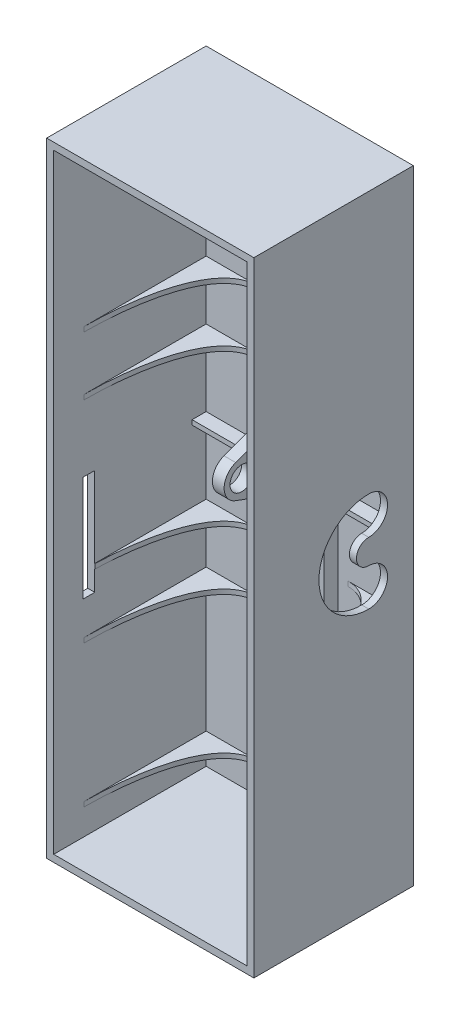
from build123d import *

# Parameters (mm, degrees)
BOSS_EXTRUDE1_DEPTH      = 68
SKETCH2_W                = 88.35
SKETCH2_H                = 263
BOSS_EXTRUDE2_DEPTH      = 3
SKETCH3_R                = 5
BOSS_EXTRUDE3_DEPTH      = 5
BOSS_EXTRUDE6_START      = 8
BOSS_EXTRUDE6_DEPTH      = 8
M6_CLEARANCE_HOLE1_D     = 6.6
M6_CLEARANCE_HOLE1_DEPTH = 8
CUT_EXTRUDE1_REACH       = 286.827
SKETCH11_W               = 88.35
SKETCH11_H               = 68
BOSS_EXTRUDE7_DEPTH      = 3
SKETCH13_W               = 21.852514987
SKETCH13_H               = 2
BOSS_EXTRUDE8_DEPTH      = 52
CUT_EXTRUDE2_REACH       = 277.542
SKETCH15_W               = 2
SKETCH15_H               = 260
SKETCH15_W_2             = 26.175
SKETCH15_H_2             = 2
SKETCH15_W_3             = 23.175
BOSS_EXTRUDE9_DEPTH      = 6
SKETCH16_W               = 15
SKETCH16_H               = 50
BOSS_EXTRUDE10_DEPTH     = 4
M6_TAPPED_HOLE2_D        = 5
SKETCH20_W               = 5
SKETCH20_H               = 45
CUT_EXTRUDE4_DEPTH       = 10


with BuildPart() as part:
    # Sketch1 → Boss-Extrude1 (new body)
    with BuildSketch(Plane.XY):
        Polygon((0, 263), (0, 0), (88.35, 0), (88.35, 263.092759022), (85.35, 263.092759022), (85.35, 3), (3, 3), (3, 263), align=None)
    extrude(amount=BOSS_EXTRUDE1_DEPTH)

    # Sketch2 → Boss-Extrude2 (add)
    with BuildSketch(Plane.XY):
        with Locations((44.175, 131.5)):
            Rectangle(SKETCH2_W, SKETCH2_H)
    extrude(amount=BOSS_EXTRUDE2_DEPTH)

    # Sketch3 → Boss-Extrude3 (add)
    with BuildSketch(Plane(origin=(34.175, 0, 0), x_dir=(0, 0, -1), z_dir=(1, 0, 0))):
        with BuildLine():
            Line((-21.565151075, 140.047694656), (-3, 146.804857042))
            Line((-3, 146.804857042), (-3, 119.195142958))
            Line((-3, 119.195142958), (-21.565151075, 125.952305344))
            ThreePointArc((-21.565151075, 125.952305344), (-26.5, 133), (-21.565151075, 140.047694656))
        make_face()
        with Locations(Location((-19, 133, 0), (0, 0, 90))):
            Circle(SKETCH3_R, mode=Mode.SUBTRACT)
    extrude(amount=-BOSS_EXTRUDE3_DEPTH)

    # Sketch6 → Boss-Extrude6 (add)
    with BuildSketch(Plane(origin=(54.175, 0, 0), x_dir=(0, 0, -1), z_dir=(1, 0, 0)).offset(BOSS_EXTRUDE6_START)):
        with BuildLine():
            Line((-19, 138), (-3, 138))
            Line((-3, 138), (-3, 128))
            Line((-3, 128), (-19, 128))
            ThreePointArc((-19, 128), (-24, 133), (-19, 138))
        make_face()
    extrude(amount=-BOSS_EXTRUDE6_DEPTH)

    # M6 Clearance Hole1
    with Locations(Plane.ZY.offset(-54.175)):
        with Locations((19, 133)):
            Hole(M6_CLEARANCE_HOLE1_D / 2, depth=M6_CLEARANCE_HOLE1_DEPTH)

    # Sketch10 → Cut-Extrude1 (cut, up to next)
    with BuildSketch(Plane.ZY.offset(-85.35), mode=Mode.PRIVATE) as cut_extrude1_sk1:
        with BuildLine():
            ThreePointArc((19, 111.75), (40.25, 133), (19, 154.25))
            ThreePointArc((19, 154.25), (11, 146.25), (19, 138.25))
            ThreePointArc((19, 138.25), (24.25, 133), (19, 127.75))
            ThreePointArc((19, 127.75), (11, 119.75), (19, 111.75))
        make_face()
    cut_extrude1_tool1 = extrude(cut_extrude1_sk1.sketch, amount=-CUT_EXTRUDE1_REACH, mode=Mode.PRIVATE) & part.part
    add(cut_extrude1_tool1.solids().sort_by_distance((85.35, 133, 25.479221))[0], mode=Mode.SUBTRACT)

    # Sketch11 → Boss-Extrude7 (add)
    with BuildSketch(Plane(origin=(0, 263, 0), x_dir=(1, 0, 0), z_dir=(0, 1, 0))):
        with Locations((44.175, -34)):
            Rectangle(SKETCH11_W, SKETCH11_H)
    extrude(amount=BOSS_EXTRUDE7_DEPTH)

    # Sketch13 → Boss-Extrude8 (add)
    with BuildSketch(Plane.XY.offset(3)):
        with Locations((13.926257494, 250.979741765)):
            Rectangle(SKETCH13_W, SKETCH13_H)
        with Locations((13.926257494, 190.418933856)):
            Rectangle(SKETCH13_W, SKETCH13_H)
        with Locations((13.926257494, 165.349802202)):
            Rectangle(SKETCH13_W, SKETCH13_H)
        with Locations((13.926257494, 15.020258235)):
            Rectangle(SKETCH13_W, SKETCH13_H)
        with Locations((13.926257494, 75.581066144)):
            Rectangle(SKETCH13_W, SKETCH13_H)
        with Locations((13.926257494, 100.650197798)):
            Rectangle(SKETCH13_W, SKETCH13_H)
    boss_extrude8 = extrude(amount=BOSS_EXTRUDE8_DEPTH)

    # Cut-Extrude2: up to this face of the body (flat: up to its plane)
    cut_extrude2_end = Plane(part.part.faces().sort_by_distance((13.926257494, 251.979741765, 29))[0])
    # Sketch14 → Cut-Extrude2 (cut, up to the picked face)
    with BuildSketch(Plane.XZ.offset(-14.020258235), mode=Mode.PRIVATE) as cut_extrude2_sk1:
        with BuildLine():
            Line((24.852514987, 3), (24.852514987, 55))
            Line((24.852514987, 55), (3, 55))
            add(Edge.make_bspline(
                [(3, 55), (3, 38.07209504), (6.271591764, 3), (24.852514987, 3)],
                knots=[0, 0, 0, 0, 1, 1, 1, 1], degree=3))
        make_face()
    cut_extrude2_tool1 = split(extrude(cut_extrude2_sk1.sketch, amount=-CUT_EXTRUDE2_REACH, mode=Mode.PRIVATE), bisect_by=cut_extrude2_end, keep=Keep.BOTH, mode=Mode.PRIVATE)
    cut_extrude2 = cut_extrude2_tool1.solids().sort_by(Axis((15.415824, 14.020258, 32.441984), (0, 1, 0)))[0]
    add(cut_extrude2, mode=Mode.SUBTRACT)

    # Mirror3: Boss-Extrude8, Cut-Extrude2 across plane
    add(boss_extrude8.mirror(Plane(origin=(44.175, 0, 0), x_dir=(0, 0, 1), z_dir=(1, 0, 0))))
    add(cut_extrude2.mirror(Plane(origin=(44.175, 0, 0), x_dir=(0, 0, 1), z_dir=(1, 0, 0))), mode=Mode.SUBTRACT)

    # Sketch15 → Boss-Extrude9 (add)
    with BuildSketch(Plane.XY.offset(3)):
        with Locations((31.675, 133)):
            Rectangle(SKETCH15_W, SKETCH15_H)
        with Locations((58.175, 133)):
            Rectangle(SKETCH15_W, SKETCH15_H)
        with Locations((16.0875, 133)):
            Rectangle(SKETCH15_W_2, SKETCH15_H_2)
        with Locations((73.7625, 133)):
            Rectangle(SKETCH15_W_3, SKETCH15_H_2)
    extrude(amount=BOSS_EXTRUDE9_DEPTH)

    # Sketch16 → Boss-Extrude10 (add)
    with BuildSketch(Plane.XY.offset(3)):
        with Locations((44.175, 233)):
            Rectangle(SKETCH16_W, SKETCH16_H)
        with Locations((44.175, 33)):
            Rectangle(SKETCH16_W, SKETCH16_H)
    extrude(amount=BOSS_EXTRUDE10_DEPTH)

    # M6 Tapped Hole2 (through all)
    with Locations(Plane.XY.offset(7)):
        with Locations((44.175, 250.24), (44.175, 215.76), (44.175, 50.24), (44.175, 15.76)):
            Hole(M6_TAPPED_HOLE2_D / 2)

    # Sketch20 → Cut-Extrude4 (cut, symmetric)
    with BuildSketch(Plane(origin=(3, 0, 0), x_dir=(0, 0, -1), z_dir=(1, 0, 0))):
        with Locations((-53, 113.5)):
            Rectangle(SKETCH20_W, SKETCH20_H)
    extrude(amount=CUT_EXTRUDE4_DEPTH, both=True, mode=Mode.SUBTRACT)


solid = part.part
